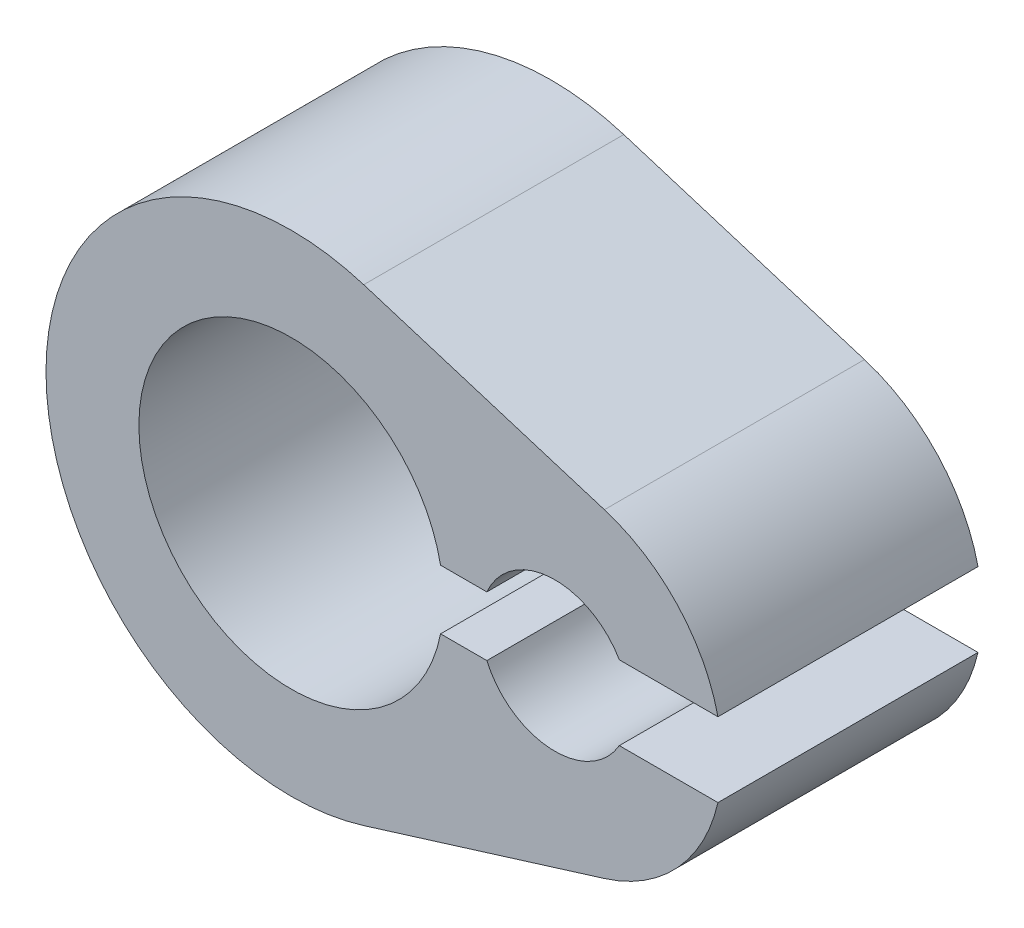
from build123d import *

# Parameters (mm, degrees)
BOSS_EXTRUDE1_DEPTH = 7


with BuildPart() as part:
    # Sketch1 → Boss-Extrude1 (new body)
    with BuildSketch(Plane.XY):
        with BuildLine():
            Line((1.952112676, 6.304701111), (8.430985915, 4.298659848))
            ThreePointArc((8.430985915, 4.298659848), (10.400834527, 3.058511308), (11.487482194, 1))
            Line((11.487482194, 1), (8.832050808, 1))
            ThreePointArc((8.832050808, 1), (6.987976728, 1.996860232), (5.266969722, 0.8))
            Line((5.266969722, 0.8), (4.021193853, 0.8))
            ThreePointArc((4.021193853, 0.8), (-4.1, 0), (4.021193853, -0.8))
            Line((4.021193853, -0.8), (5.266969722, -0.8))
            ThreePointArc((5.266969722, -0.8), (6.987976728, -1.996860232), (8.832050808, -1))
            Line((8.832050808, -1), (11.487482194, -1))
            ThreePointArc((11.487482194, -1), (10.400834527, -3.058511308), (8.430985915, -4.298659848))
            Line((8.430985915, -4.298659848), (1.952112676, -6.304701111))
            ThreePointArc((1.952112676, -6.304701111), (-6.6, 0), (1.952112676, 6.304701111))
        make_face()
    extrude(amount=BOSS_EXTRUDE1_DEPTH)


solid = part.part
